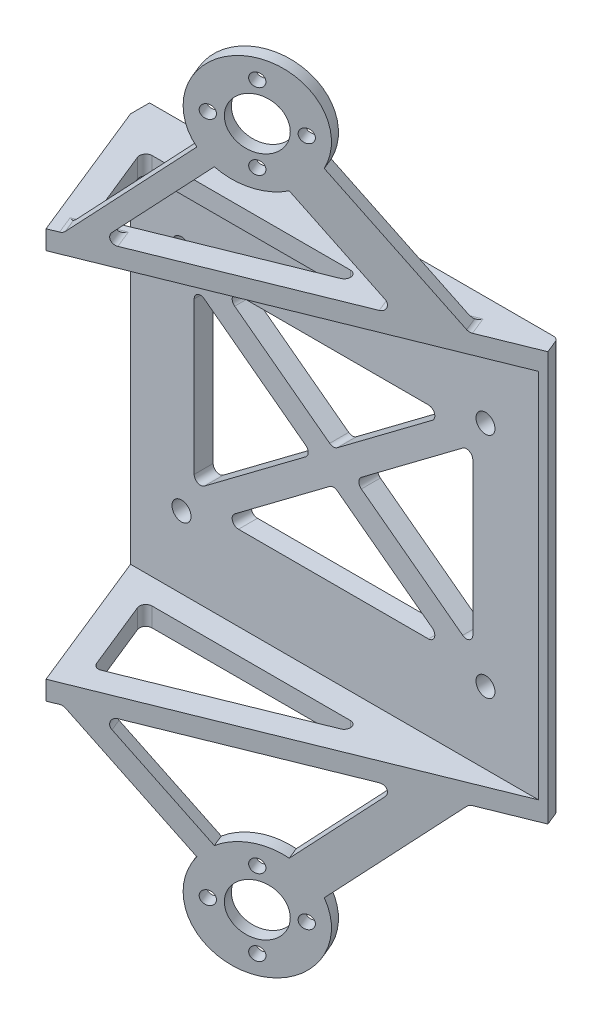
from build123d import *

# Parameters (mm, degrees)
SKETCH_2_W          = 64.445610825
SKETCH_2_H          = 64.602792554
EXTRUDE_2_DEPTH     = 3
SKETCH_3_R          = 1.5
CUT_EXTRUDE_1_DEPTH = 4
EXTRUDE_3_DEPTH     = 3
EXTRUDE_4_DEPTH     = 3
EXTRUDE_6_DEPTH     = 64.602792554
SKETCH_11_R         = 1.05
SKETCH_11_R_2       = 4
EXTRUDE_7_DEPTH     = 2
FILLET_1_R          = 1
FILLET_2_R          = 1
FILLET_3_R          = 1
CUT_EXTRUDE_3_DEPTH = 75.557406075
FILLET_5_R          = 1


with BuildPart() as part:
    # 草图2 → 凸台-拉伸2 (new body)
    with BuildSketch(Plane.XY):
        with Locations((0.170214688, -0.018389364)):
            Rectangle(SKETCH_2_W, SKETCH_2_H)
    extrude(amount=EXTRUDE_2_DEPTH)

    # 草图3 → 切除-拉伸1 (cut)
    with BuildSketch(Plane.XY):
        with Locations((24, -18)):
            Circle(SKETCH_3_R)
        with Locations((-24, -18)):
            Circle(SKETCH_3_R)
        with Locations((-24, 18)):
            Circle(SKETCH_3_R)
        with Locations((24, 18)):
            Circle(SKETCH_3_R)
    extrude(amount=CUT_EXTRUDE_1_DEPTH, mode=Mode.SUBTRACT)

    # 草图9 → 凸台-拉伸3 (add)
    with BuildSketch(Plane(origin=(0, 32.283006913, 0), x_dir=(1, 0, 0), z_dir=(0, 1, 0))):
        Polygon((-32.052590724, -3), (32.393020101, -3), (-23.008931723, -25.383841499), align=None)
        Polygon((-20.798622679, -20.176679707), (11.814804037, -7), (-26.12234685, -7), align=None, mode=Mode.SUBTRACT)
    extrude(amount=-EXTRUDE_3_DEPTH)

    # 草图10 → 凸台-拉伸4 (add)
    with BuildSketch(Plane.XZ.offset(32.319785641)):
        Polygon((-23.008931723, 25.383841499), (-32.052590724, 3), (32.393020101, 3), align=None)
        Polygon((11.814804037, 7), (-20.798622679, 20.176679707), (-26.12234685, 7), align=None, mode=Mode.SUBTRACT)
    extrude(amount=-EXTRUDE_4_DEPTH)

    # 草图13 → 凸台-拉伸6 (add)
    with BuildSketch(Plane(origin=(0, 32.283006913, 0), x_dir=(1, 0, 0), z_dir=(0, 1, 0))):
        Polygon((32.393020101, -3), (33.435007656, -2.579009701), (32.393020101, 0), align=None)
    extrude(amount=-EXTRUDE_6_DEPTH)

    # 草图11 → 凸台-拉伸7 (add)
    # profile 1 of 2: a face of its own
    with BuildSketch(Plane(origin=(5.5877033, 0, 13.830050979), x_dir=(0.9271838545667869, 0, -0.37460659341591335), z_dir=(0.37460659341591335, 0, 0.9271838545667869))):
        with BuildLine():
            Line((-1.337035106, 45.610290293), (11.990248274, 32.283006913))
            Line((11.990248274, 32.283006913), (20.475529648, 32.283006913))
            Line((20.475529648, 32.283006913), (2.905605582, 49.85293098))
            ThreePointArc((2.905605582, 49.85293098), (-5.990504286, 62.698198683), (-12.551325133, 48.517320609))
            Line((-12.551325133, 48.517320609), (-28.785638829, 32.283006913))
            Line((-28.785638829, 32.283006913), (-24.542998142, 32.283006913))
            Line((-24.542998142, 32.283006913), (-10.430004789, 46.396000265))
            ThreePointArc((-10.430004789, 46.396000265), (-5.990504286, 44.76502259), (-1.337035106, 45.610290293))
        make_face()
        with Locations((0.784285238, 53.731610636)):
            Circle(SKETCH_11_R, mode=Mode.SUBTRACT)
        with Locations((-11.215714762, 53.731610636)):
            Circle(SKETCH_11_R, mode=Mode.SUBTRACT)
        with Locations((-5.215714762, 47.731610636)):
            Circle(SKETCH_11_R, mode=Mode.SUBTRACT)
        with Locations((-5.215714762, 53.731610636)):
            Circle(SKETCH_11_R_2, mode=Mode.SUBTRACT)
        with Locations((-5.215714762, 59.731610636)):
            Circle(SKETCH_11_R, mode=Mode.SUBTRACT)
    # profile 2 of 2: a face of its own
    with BuildSketch(Plane(origin=(5.5877033, 0, 13.830050979), x_dir=(0.9271838545667869, 0, -0.37460659341591335), z_dir=(0.37460659341591335, 0, 0.9271838545667869))):
        with BuildLine():
            Line((11.990248274, -32.319785641), (-1.337035106, -45.64706902))
            ThreePointArc((-1.337035106, -45.64706902), (-5.990504286, -44.801801317), (-10.430004789, -46.432778993))
            Line((-10.430004789, -46.432778993), (-24.542998142, -32.319785641))
            Line((-24.542998142, -32.319785641), (-28.785638829, -32.319785641))
            Line((-28.785638829, -32.319785641), (-12.551325133, -48.554099337))
            ThreePointArc((-12.551325133, -48.554099337), (-5.990504286, -62.73497741), (2.905605582, -49.889709707))
            Line((2.905605582, -49.889709707), (20.475529648, -32.319785641))
            Line((20.475529648, -32.319785641), (11.990248274, -32.319785641))
        make_face()
        with Locations((0.784285238, -53.768389364)):
            Circle(SKETCH_11_R, mode=Mode.SUBTRACT)
        with Locations((-11.215714762, -53.768389364)):
            Circle(SKETCH_11_R, mode=Mode.SUBTRACT)
        with Locations((-5.215714762, -59.768389364)):
            Circle(SKETCH_11_R, mode=Mode.SUBTRACT)
        with Locations((-5.215714762, -53.768389364)):
            Circle(SKETCH_11_R_2, mode=Mode.SUBTRACT)
        with Locations((-5.215714762, -47.768389364)):
            Circle(SKETCH_11_R, mode=Mode.SUBTRACT)
    extrude(amount=-EXTRUDE_7_DEPTH)

    # 圆角1
    fillet_1_edges = [part.edges().sort_by_distance(p)[0] for p in [
        (32.393020101, -0.018389364, 0),
    ]]
    fillet(fillet_1_edges, radius=FILLET_1_R)

    # 圆角2
    fillet_2_edges = [part.edges().sort_by_distance(p)[0] for p in [
        (16.330261319, -32.319785641, 8.411241064),
        (24.19767721, -32.319785641, 5.232598715),
        (-21.476482859, -32.319785641, 23.686157226),
        (-17.542774913, -32.319785641, 22.096836051),
        (19.889362671, -32.319785641, 5.894736035),
        (-19.884235479, -32.319785641, 21.964312784),
        (24.19767721, 32.283006913, 5.232598715),
        (16.330261319, 32.283006913, 8.411241064),
        (-17.542774913, 32.283006913, 22.096836051),
        (-21.476482859, 32.283006913, 23.686157226),
        (19.889362671, 32.283006913, 5.894736035),
        (-19.884235479, 32.283006913, 21.964312784),
    ]]
    fillet(fillet_2_edges, radius=FILLET_2_R)

    # 圆角3
    fillet_3_edges = [part.edges().sort_by_distance(p)[0] for p in [
        (-26.12234685, 30.783006913, 7),
        (11.814804037, 30.783006913, 7),
        (-20.798622679, 30.783006913, 20.176679707),
        (-26.12234685, -30.819785641, 7),
        (-20.798622679, -30.819785641, 20.176679707),
        (11.814804037, -30.819785641, 7),
    ]]
    fillet(fillet_3_edges, radius=FILLET_3_R)

    # 草图15 → 切除-拉伸3 (cut, through all)
    with BuildSketch(Plane.XY.offset(3)):
        Polygon((-18, 16), (18, 16), (0, 2.5), align=None)
        Polygon((-22, 14), (-3.333333333, 0), (-22, -14), align=None)
        Polygon((-18, -16), (18, -16), (0, -2.5), align=None)
        Polygon((22, 14), (3.333333333, 0), (22, -14), align=None)
    extrude(amount=-CUT_EXTRUDE_3_DEPTH, mode=Mode.SUBTRACT)

    # 圆角5
    fillet_5_edges = [part.edges().sort_by_distance(p)[0] for p in [
        (-18, -16, 1.5),
        (0, -2.5, 1.5),
        (18, -16, 1.5),
        (-22, -14, 1.5),
        (-22, 14, 1.5),
        (-3.333333333, 0, 1.5),
        (22, 14, 1.5),
        (22, -14, 1.5),
        (3.333333333, 0, 1.5),
        (0, 2.5, 1.5),
        (-18, 16, 1.5),
        (18, 16, 1.5),
    ]]
    fillet(fillet_5_edges, radius=FILLET_5_R)


solid = part.part
